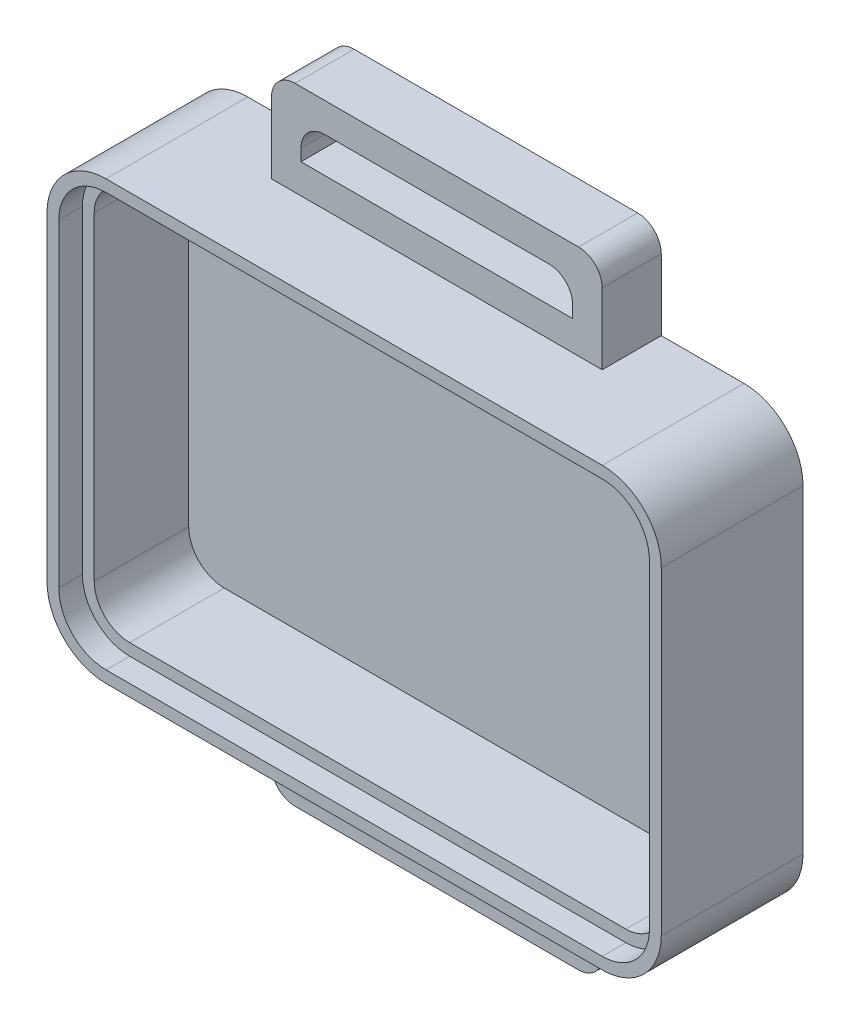
from build123d import *

# Parameters (mm, degrees)
BOSS_EXTRU_1_DEPTH      = 12
COQUE5_T                = -2
ENL_V_MAT_EXTRU_1_DEPTH = 2
BOSS_EXTRU_5_DEPTH      = 5


with BuildPart() as part:
    # Esquisse1 → Boss.-Extru.1 (new body)
    with BuildSketch(Plane.XY):
        with BuildLine():
            Line((5, 0), (47, 0))
            ThreePointArc((47, 0), (50.535533906, 1.464466094), (52, 5))
            Line((52, 5), (52, 32))
            ThreePointArc((52, 32), (50.535533906, 35.535533906), (47, 37))
            Line((47, 37), (5, 37))
            ThreePointArc((5, 37), (1.464466094, 35.535533906), (0, 32))
            Line((0, 32), (0, 5))
            ThreePointArc((0, 5), (1.464466094, 1.464466094), (5, 0))
        make_face()
    extrude(amount=BOSS_EXTRU_1_DEPTH)

    # Coque5
    coque5_openings = [part.faces().sort_by_distance(p)[0] for p in [
        (26, 18.5, 12),
    ]]
    offset(amount=COQUE5_T, openings=coque5_openings, kind=Kind.INTERSECTION)

    # Esquisse3 → Enlèv. mat.-Extru.1 (cut)
    with BuildSketch(Plane.XY.offset(12)):
        with BuildLine():
            ThreePointArc((51, 32), (49.828427125, 34.828427125), (47, 36))
            Line((47, 36), (5, 36))
            ThreePointArc((5, 36), (2.171572875, 34.828427125), (1, 32))
            Line((1, 32), (1, 5))
            ThreePointArc((1, 5), (2.171572875, 2.171572875), (5, 1))
            Line((5, 1), (47, 1))
            ThreePointArc((47, 1), (49.828427125, 2.171572875), (51, 5))
            Line((51, 5), (51, 32))
        make_face()
    extrude(amount=-ENL_V_MAT_EXTRU_1_DEPTH, mode=Mode.SUBTRACT)

    # Esquisse10 → Boss.-Extru.5 (add)
    # profile 1 of 2: a face of its own
    with BuildSketch(Plane(origin=(0, 0, 0), x_dir=(-1, 0, 0), z_dir=(0, 0, -1))):
        with BuildLine():
            Line((-40, 37), (-12, 37))
            Line((-12, 37), (-12, 43))
            ThreePointArc((-12, 43), (-12.585786438, 44.414213562), (-14, 45))
            Line((-14, 45), (-38, 45))
            ThreePointArc((-38, 45), (-39.414213562, 44.414213562), (-40, 43))
            Line((-40, 43), (-40, 37))
        make_face()
        with BuildLine():
            Line((-37.5, 39.5), (-37.5, 40.5))
            ThreePointArc((-37.5, 40.5), (-36.914213562, 41.914213562), (-35.5, 42.5))
            Line((-35.5, 42.5), (-16.5, 42.5))
            ThreePointArc((-16.5, 42.5), (-15.085786438, 41.914213562), (-14.5, 40.5))
            Line((-14.5, 40.5), (-14.5, 39.5))
            Line((-14.5, 39.5), (-37.5, 39.5))
        make_face(mode=Mode.SUBTRACT)
    # profile 2 of 2: a face of its own
    with BuildSketch(Plane(origin=(0, 0, 0), x_dir=(-1, 0, 0), z_dir=(0, 0, -1))):
        with BuildLine():
            Line((-40, 0), (-12, 0))
            Line((-12, 0), (-12, -6))
            ThreePointArc((-12, -6), (-12.585786438, -7.414213562), (-14, -8))
            Line((-14, -8), (-38, -8))
            ThreePointArc((-38, -8), (-39.414213562, -7.414213562), (-40, -6))
            Line((-40, -6), (-40, 0))
        make_face()
        with BuildLine():
            Line((-37.5, -2.5), (-37.5, -3.5))
            ThreePointArc((-37.5, -3.5), (-36.914213562, -4.914213562), (-35.5, -5.5))
            Line((-35.5, -5.5), (-16.5, -5.5))
            ThreePointArc((-16.5, -5.5), (-15.085786438, -4.914213562), (-14.5, -3.5))
            Line((-14.5, -3.5), (-14.5, -2.5))
            Line((-14.5, -2.5), (-37.5, -2.5))
        make_face(mode=Mode.SUBTRACT)
    extrude(amount=-BOSS_EXTRU_5_DEPTH)


solid = part.part
